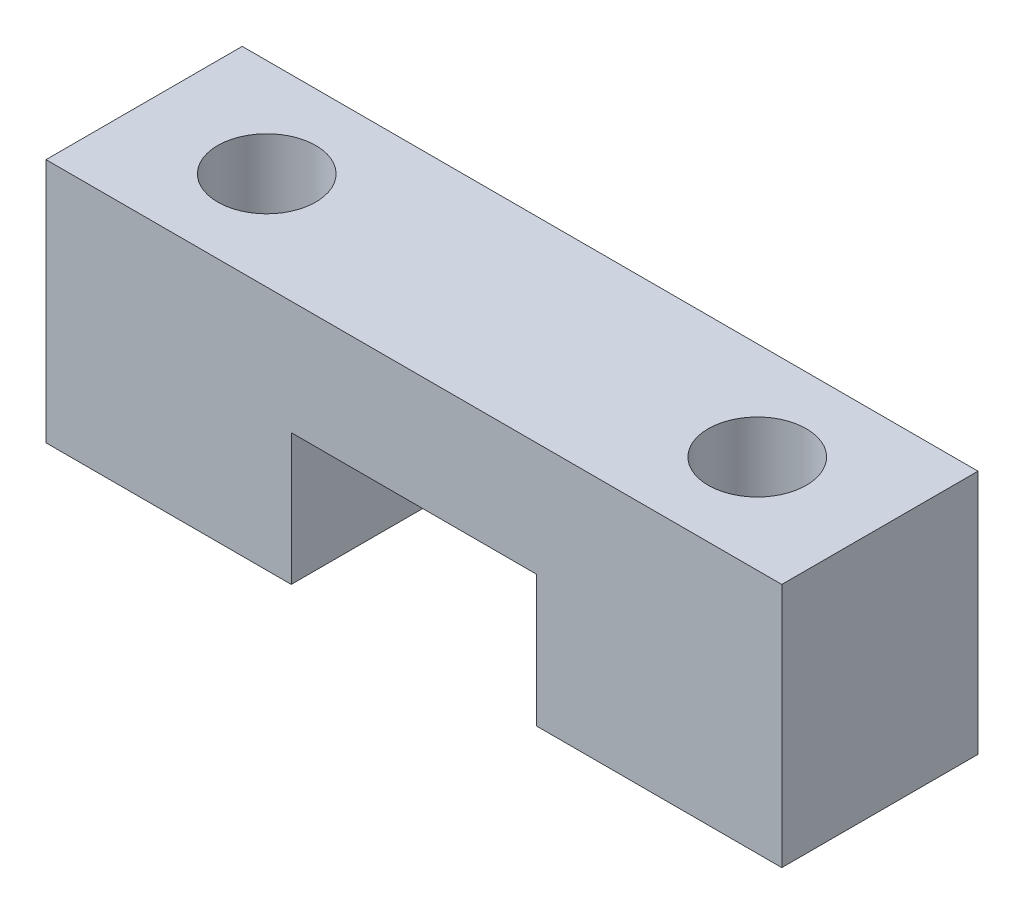
from build123d import *

# Parameters (mm, degrees)
BOSS_EXTRUDE1_DEPTH = 5.08
SKETCH2_R           = 1.27
CUT_EXTRUDE1_DEPTH  = 21.713073166


with BuildPart() as part:
    # Sketch1 → Boss-Extrude1 (new body)
    with BuildSketch(Plane.XY):
        Polygon((0, 0), (6.35, 0), (6.35, 3.4036), (12.7, 3.4036), (12.7, 0), (19.05, 0), (19.05, 6.35), (0, 6.35), align=None)
    extrude(amount=BOSS_EXTRUDE1_DEPTH)

    # Sketch2 → Cut-Extrude1 (cut, through all)
    with BuildSketch(Plane(origin=(0, 6.35, 0), x_dir=(1, 0, 0), z_dir=(0, 1, 0))):
        with Locations(Location((3.175, -2.54, 0), (0, 0, 180))):
            Circle(SKETCH2_R)
        with Locations(Location((15.875, -2.54, 0), (0, 0, 180))):
            Circle(SKETCH2_R)
    extrude(amount=-CUT_EXTRUDE1_DEPTH, mode=Mode.SUBTRACT)


solid = part.part
